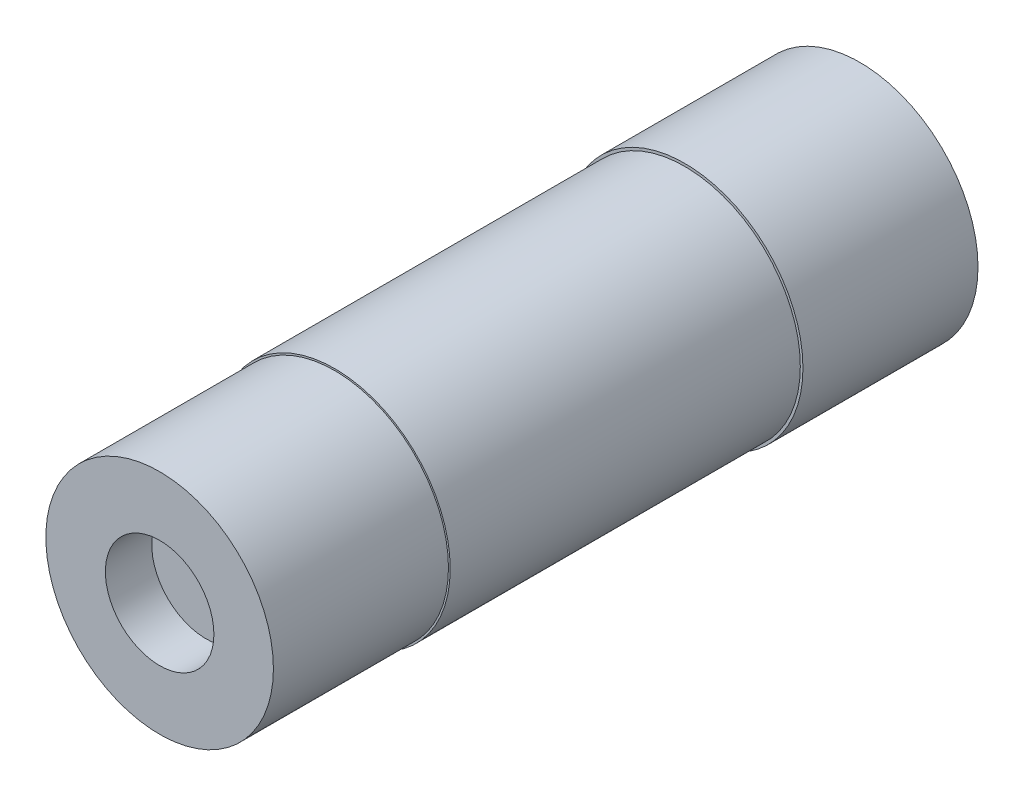
from build123d import *

# Parameters (mm, degrees)
SKETCH1_R           = 6.75
SKETCH1_R_2         = 2.725
BOSS_EXTRUDE2_DEPTH = 10
SKETCH2_R           = 6.6
BOSS_EXTRUDE3_DEPTH = 30
CUT_EXTRUDE1_START  = -10
SKETCH3_R           = 6.6
SKETCH3_R_2         = 6.5
CUT_EXTRUDE1_DEPTH  = 10
SKETCH4_R           = 3.1
CUT_EXTRUDE3_DEPTH  = 2.65


with BuildPart() as part:
    # Sketch1 → Boss-Extrude2 (new body)
    with BuildSketch(Plane.XY):
        Circle(SKETCH1_R)
        Circle(SKETCH1_R_2, mode=Mode.SUBTRACT)
    extrude(amount=BOSS_EXTRUDE2_DEPTH)

    # Sketch2 → Boss-Extrude3 (add)
    with BuildSketch(Plane.XY.offset(10)):
        Circle(SKETCH2_R)
    extrude(amount=BOSS_EXTRUDE3_DEPTH)

    # Sketch3 → Cut-Extrude1 (cut)
    with BuildSketch(Plane.XY.offset(40).offset(CUT_EXTRUDE1_START)):
        Circle(SKETCH3_R)
        Circle(SKETCH3_R_2, mode=Mode.SUBTRACT)
    extrude(amount=CUT_EXTRUDE1_DEPTH, mode=Mode.SUBTRACT)

    # Sketch4 → Cut-Extrude3 (cut)
    with BuildSketch(Plane.XY.offset(40)):
        Circle(SKETCH4_R)
    extrude(amount=-CUT_EXTRUDE3_DEPTH, mode=Mode.SUBTRACT)


solid = part.part
